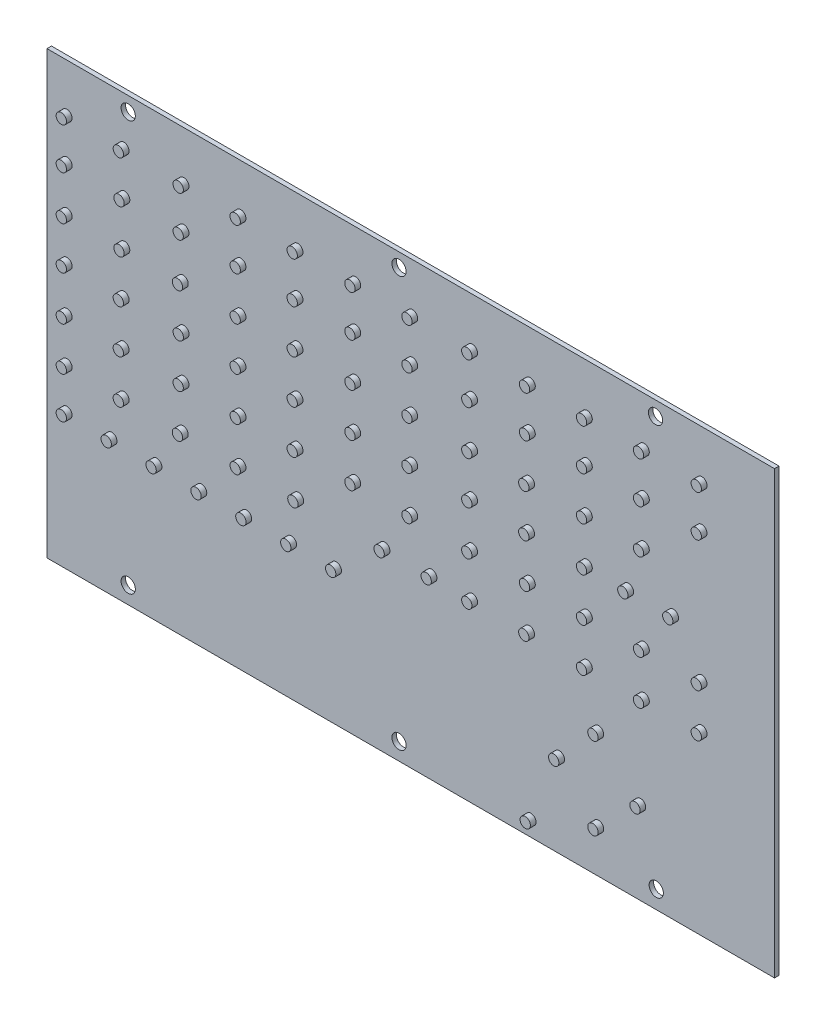
from build123d import *

# Parameters (mm, degrees)
SKETCH_2_W          = 129.667
SKETCH_2_H          = 78.613
EXTRUDE_1_DEPTH     = 0.8
SKETCH_3_R          = 1.27
CUT_EXTRUDE_1_DEPTH = 12.54
SKETCH_4_R          = 0.92202
SKETCH_4_R_2        = 0.922029104
SKETCH_4_R_3        = 0.919681264
SKETCH_4_R_4        = 0.924963229
SKETCH_4_R_5        = 0.92552898
EXTRUDE_2_DEPTH     = 1


with BuildPart() as part:
    # 草图2 → 凸台-拉伸1 (new body)
    with BuildSketch(Plane.XY):
        with Locations((83.3755, 41.2115)):
            Rectangle(SKETCH_2_W, SKETCH_2_H)
    extrude(amount=EXTRUDE_1_DEPTH)

    # 草图3 → 切除-拉伸1 (cut)
    with BuildSketch(Plane.XY.offset(0.8)):
        with Locations((33.02, 77.978)):
            Circle(SKETCH_3_R)
        with Locations((81.28, 78.105)):
            Circle(SKETCH_3_R)
        with Locations((127, 77.978)):
            Circle(SKETCH_3_R)
        with Locations((33.02, 4.953)):
            Circle(SKETCH_3_R)
        with Locations((81.28, 4.953)):
            Circle(SKETCH_3_R)
        with Locations((127.127, 5.08)):
            Circle(SKETCH_3_R)
    extrude(amount=-CUT_EXTRUDE_1_DEPTH, mode=Mode.SUBTRACT)

    # 草图4 → 凸台-拉伸2 (add)
    with BuildSketch(Plane.XY.offset(0.8)):
        with Locations((22.098, 72.009)):
            Circle(SKETCH_4_R)
        with Locations((22.098, 64.643)):
            Circle(SKETCH_4_R)
        with Locations((22.098, 56.769)):
            Circle(SKETCH_4_R)
        with Locations((22.098, 49.149)):
            Circle(SKETCH_4_R)
        with Locations((22.098, 26.162)):
            Circle(SKETCH_4_R)
        with Locations((22.098, 33.528)):
            Circle(SKETCH_4_R)
        with Locations((22.098, 41.275)):
            Circle(SKETCH_4_R)
        with Locations((32.258, 72.009)):
            Circle(SKETCH_4_R)
        with Locations((42.926, 71.882)):
            Circle(SKETCH_4_R)
        with Locations((53.086, 72.009)):
            Circle(SKETCH_4_R)
        with Locations((63.246, 71.882)):
            Circle(SKETCH_4_R)
        with Locations((73.533, 71.882)):
            Circle(SKETCH_4_R)
        with Locations((83.693, 71.882)):
            Circle(SKETCH_4_R)
        with Locations((94.361, 71.882)):
            Circle(SKETCH_4_R)
        with Locations((104.648, 71.882)):
            Circle(SKETCH_4_R)
        with Locations((114.808, 71.882)):
            Circle(SKETCH_4_R)
        with Locations((124.968, 71.882)):
            Circle(SKETCH_4_R)
        with Locations((135.255, 71.882)):
            Circle(SKETCH_4_R)
        with Locations((32.385, 64.516)):
            Circle(SKETCH_4_R)
        with Locations((32.385, 56.769)):
            Circle(SKETCH_4_R)
        with Locations((32.258, 49.022)):
            Circle(SKETCH_4_R)
        with Locations((32.258, 33.528)):
            Circle(SKETCH_4_R)
        with Locations((32.258, 41.275)):
            Circle(SKETCH_4_R)
        with Locations((54.102, 26.162)):
            Circle(SKETCH_4_R)
        with Locations((30.099, 26.162)):
            Circle(SKETCH_4_R)
        with Locations((38.1, 26.162)):
            Circle(SKETCH_4_R)
        with Locations((46.101, 26.162)):
            Circle(SKETCH_4_R)
        with Locations((42.926, 64.643)):
            Circle(SKETCH_4_R)
        with Locations((42.799, 56.769)):
            Circle(SKETCH_4_R)
        with Locations((53.086, 64.516)):
            Circle(SKETCH_4_R)
        with Locations((63.246, 64.516)):
            Circle(SKETCH_4_R)
        with Locations((53.086, 56.769)):
            Circle(SKETCH_4_R)
        with Locations((63.246, 56.769)):
            Circle(SKETCH_4_R)
        with Locations((42.937232377, 49.080669284)):
            Circle(SKETCH_4_R)
        with Locations((53.086, 49.022)):
            Circle(SKETCH_4_R)
        with Locations((63.246, 49.022)):
            Circle(SKETCH_4_R)
        with Locations((42.927878215, 41.278345649)):
            Circle(SKETCH_4_R)
        with Locations((42.78999374, 33.521368778)):
            Circle(SKETCH_4_R)
        with Locations((53.086, 33.528)):
            Circle(SKETCH_4_R)
        with Locations((53.096022403, 41.290450758)):
            Circle(SKETCH_4_R)
        with Locations((104.775, 4.699)):
            Circle(SKETCH_4_R)
        with Locations((116.84, 9.652)):
            Circle(SKETCH_4_R_2)
        with Locations((109.855, 16.891)):
            Circle(SKETCH_4_R)
        with Locations((124.333, 16.764)):
            Circle(SKETCH_4_R_3)
        with Locations((116.84, 24.257)):
            Circle(SKETCH_4_R_4)
        with Locations((135.255, 33.528)):
            Circle(SKETCH_4_R_5)
        with Locations((135.255, 41.275)):
            Circle(SKETCH_4_R)
        with Locations((124.968, 33.401)):
            Circle(SKETCH_4_R)
        with Locations((124.968, 41.275)):
            Circle(SKETCH_4_R)
        with Locations((114.808, 33.401)):
            Circle(SKETCH_4_R)
        with Locations((114.808, 41.148)):
            Circle(SKETCH_4_R)
        with Locations((130.175, 48.895)):
            Circle(SKETCH_4_R)
        with Locations((122.174, 48.895)):
            Circle(SKETCH_4_R)
        with Locations((114.808, 48.895)):
            Circle(SKETCH_4_R)
        with Locations((124.968, 56.769)):
            Circle(SKETCH_4_R)
        with Locations((114.808, 56.769)):
            Circle(SKETCH_4_R)
        with Locations((114.808, 64.516)):
            Circle(SKETCH_4_R)
        with Locations((124.968, 64.516)):
            Circle(SKETCH_4_R)
        with Locations((135.255, 64.516)):
            Circle(SKETCH_4_R)
        with Locations((62.103, 26.162)):
            Circle(SKETCH_4_R)
        with Locations((70.104, 26.162)):
            Circle(SKETCH_4_R)
        with Locations((63.373, 33.528)):
            Circle(SKETCH_4_R)
        with Locations((78.74, 33.528)):
            Circle(SKETCH_4_R)
        with Locations((87.122, 33.528)):
            Circle(SKETCH_4_R)
        with Locations((104.521, 33.528)):
            Circle(SKETCH_4_R)
        with Locations((94.361, 33.401)):
            Circle(SKETCH_4_R)
        with Locations((73.533, 41.275)):
            Circle(SKETCH_4_R)
        with Locations((63.246, 41.275)):
            Circle(SKETCH_4_R)
        with Locations((83.693, 41.275)):
            Circle(SKETCH_4_R)
        with Locations((104.648, 41.275)):
            Circle(SKETCH_4_R)
        with Locations((94.361, 41.148)):
            Circle(SKETCH_4_R)
        with Locations((73.533, 49.022)):
            Circle(SKETCH_4_R)
        with Locations((83.693, 49.022)):
            Circle(SKETCH_4_R)
        with Locations((94.361, 49.022)):
            Circle(SKETCH_4_R)
        with Locations((104.521, 49.022)):
            Circle(SKETCH_4_R)
        with Locations((73.533, 64.516)):
            Circle(SKETCH_4_R)
        with Locations((73.533, 56.769)):
            Circle(SKETCH_4_R)
        with Locations((83.693, 64.516)):
            Circle(SKETCH_4_R)
        with Locations((83.693, 56.769)):
            Circle(SKETCH_4_R)
        with Locations((94.361, 64.516)):
            Circle(SKETCH_4_R)
        with Locations((94.361, 56.642)):
            Circle(SKETCH_4_R)
        with Locations((104.521, 56.642)):
            Circle(SKETCH_4_R)
        with Locations((104.648, 64.516)):
            Circle(SKETCH_4_R)
    extrude(amount=EXTRUDE_2_DEPTH)


solid = part.part
